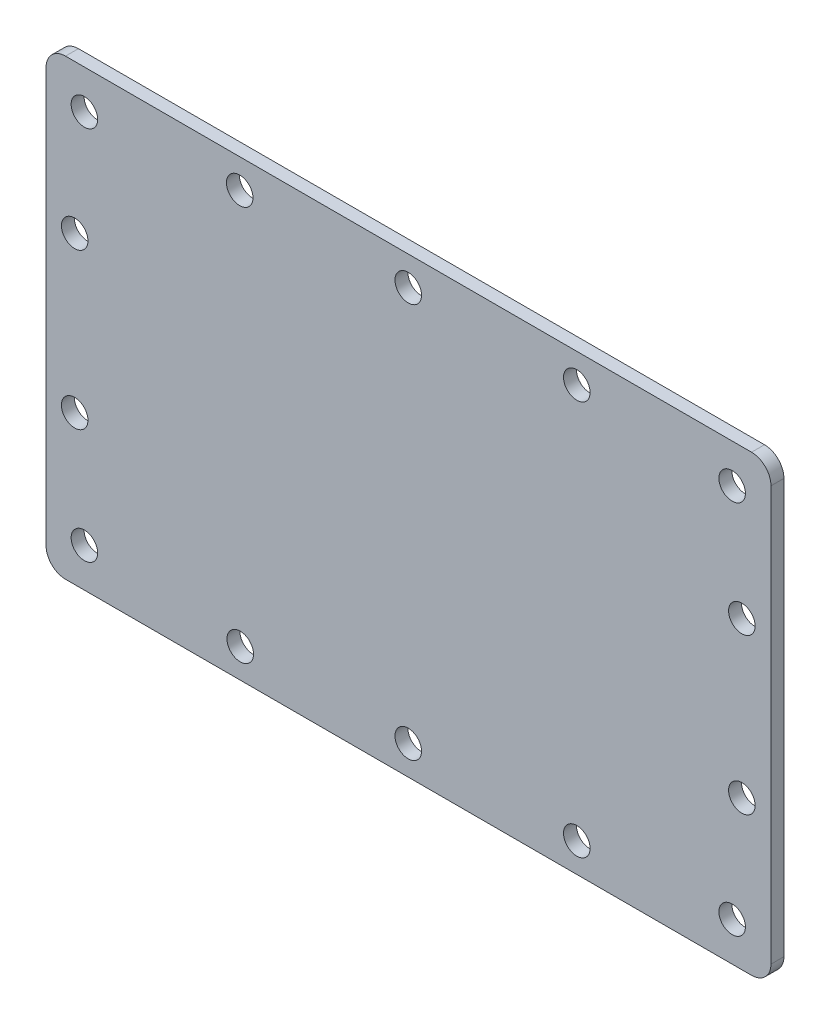
from build123d import *

# Parameters (mm, degrees)
SKETCH1_W           = 112
SKETCH1_H           = 70
BOSS_EXTRUDE1_DEPTH = 2
FILLET1_R           = 3
SKETCH2_R           = 2.05
CUT_EXTRUDE1_DEPTH  = 3


with BuildPart() as part:
    # Sketch1 → Boss-Extrude1 (new body)
    with BuildSketch(Plane.XY):
        with Locations((-34.191460674, -27.067695099)):
            Rectangle(SKETCH1_W, SKETCH1_H)
    extrude(amount=BOSS_EXTRUDE1_DEPTH)

    # Fillet1
    fillet1_edges = [part.edges().sort_by_distance(p)[0] for p in [
        (-90.191460674, 7.932304901, 1),
        (21.808539326, 7.932304901, 1),
        (21.808539326, -62.067695099, 1),
        (-90.191460674, -62.067695099, 1),
    ]]
    fillet(fillet1_edges, radius=FILLET1_R)

    # Sketch2 → Cut-Extrude1 (cut)
    with BuildSketch(Plane.XY.offset(2)):
        with Locations((-84.272277823, -56.067695099)):
            Circle(SKETCH2_R)
        with Locations((-85.772277823, -39.067695099)):
            Circle(SKETCH2_R)
        with Locations((-85.772277823, -15.067695099)):
            Circle(SKETCH2_R)
        with Locations((-84.272277823, 1.932304901)):
            Circle(SKETCH2_R)
        with Locations((-60.272277823, 3.432304901)):
            Circle(SKETCH2_R)
        with Locations((-60.191460674, -57.567695099)):
            Circle(SKETCH2_R)
        with Locations((-34.231869249, -57.567695099)):
            Circle(SKETCH2_R)
        with Locations((-34.231869249, 3.432304901)):
            Circle(SKETCH2_R)
        with Locations((-8.191460674, 3.432304901)):
            Circle(SKETCH2_R)
        with Locations((-8.191460674, -57.567695099)):
            Circle(SKETCH2_R)
        with Locations((15.808539326, -56.067695099)):
            Circle(SKETCH2_R)
        with Locations((17.308539326, -39.067695099)):
            Circle(SKETCH2_R)
        with Locations((17.308539326, -15.067695099)):
            Circle(SKETCH2_R)
        with Locations((15.808539326, 1.932304901)):
            Circle(SKETCH2_R)
    extrude(amount=-CUT_EXTRUDE1_DEPTH, mode=Mode.SUBTRACT)


solid = part.part
